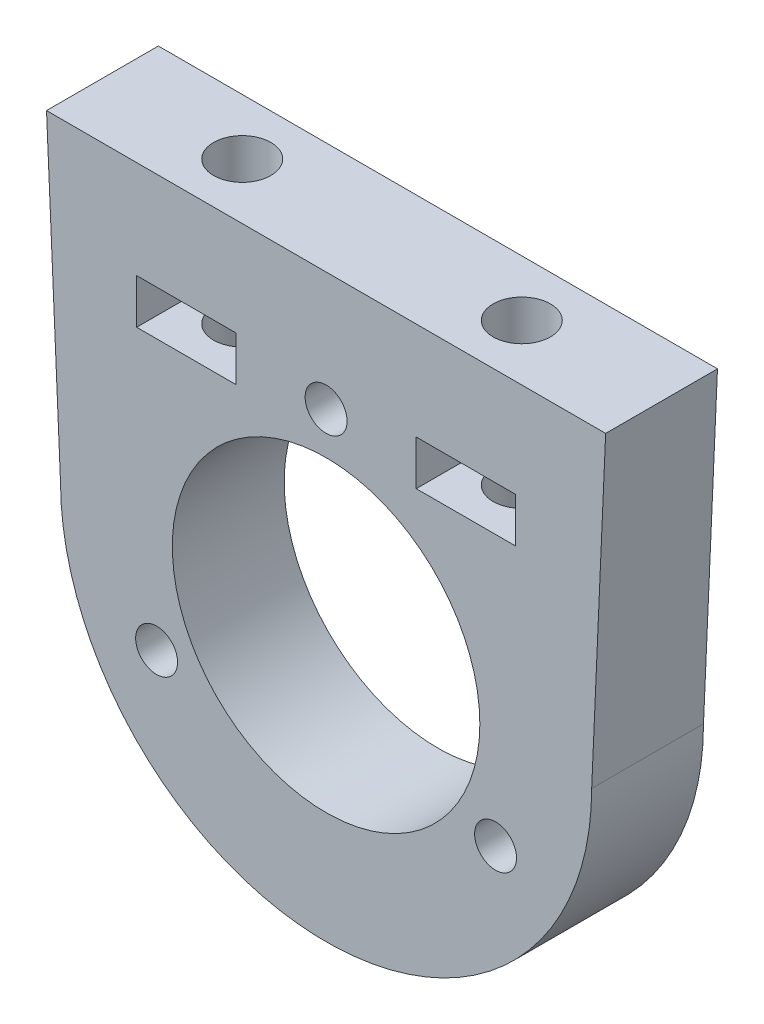
from build123d import *

# Parameters (mm, degrees)
SKETCH1_R           = 1.5
SKETCH1_R_2         = 11
BOSS_EXTRUDE1_DEPTH = 8
SKETCH4_W           = 7.1
SKETCH4_H           = 3.2
CUT_EXTRUDE1_DEPTH  = 32.148836254
SKETCH5_R           = 2.05
CUT_EXTRUDE2_DEPTH  = 14


with BuildPart() as part:
    # Sketch1 → Boss-Extrude1 (new body)
    with BuildSketch(Plane.XY):
        with BuildLine():
            Line((-19, 0), (-20, 22.5))
            Line((-20, 22.5), (20, 22.5))
            Line((20, 22.5), (19, 0))
            ThreePointArc((19, 0), (0, -19), (-19, 0))
        make_face()
        with Locations((0, 14)):
            Circle(SKETCH1_R, mode=Mode.SUBTRACT)
        Circle(SKETCH1_R_2, mode=Mode.SUBTRACT)
        with Locations((12.124355653, -7)):
            Circle(SKETCH1_R, mode=Mode.SUBTRACT)
        with Locations((-12.124355653, -7)):
            Circle(SKETCH1_R, mode=Mode.SUBTRACT)
    extrude(amount=BOSS_EXTRUDE1_DEPTH)

    # Sketch4 → Cut-Extrude1 (cut, through all)
    with BuildSketch(Plane.XY.offset(8)):
        with Locations((-10, 13.9)):
            Rectangle(SKETCH4_W, SKETCH4_H)
        with Locations((10, 13.9)):
            Rectangle(SKETCH4_W, SKETCH4_H)
    extrude(amount=-CUT_EXTRUDE1_DEPTH, mode=Mode.SUBTRACT)

    # Sketch5 → Cut-Extrude2 (cut)
    with BuildSketch(Plane(origin=(0, 22.5, 0), x_dir=(1, 0, 0), z_dir=(0, 1, 0))):
        with Locations(Location((-10, -4, 0), (0, 0, 180))):
            Circle(SKETCH5_R)
        with Locations(Location((10, -4, 0), (0, 0, 180))):
            Circle(SKETCH5_R)
    extrude(amount=-CUT_EXTRUDE2_DEPTH, mode=Mode.SUBTRACT)


solid = part.part
